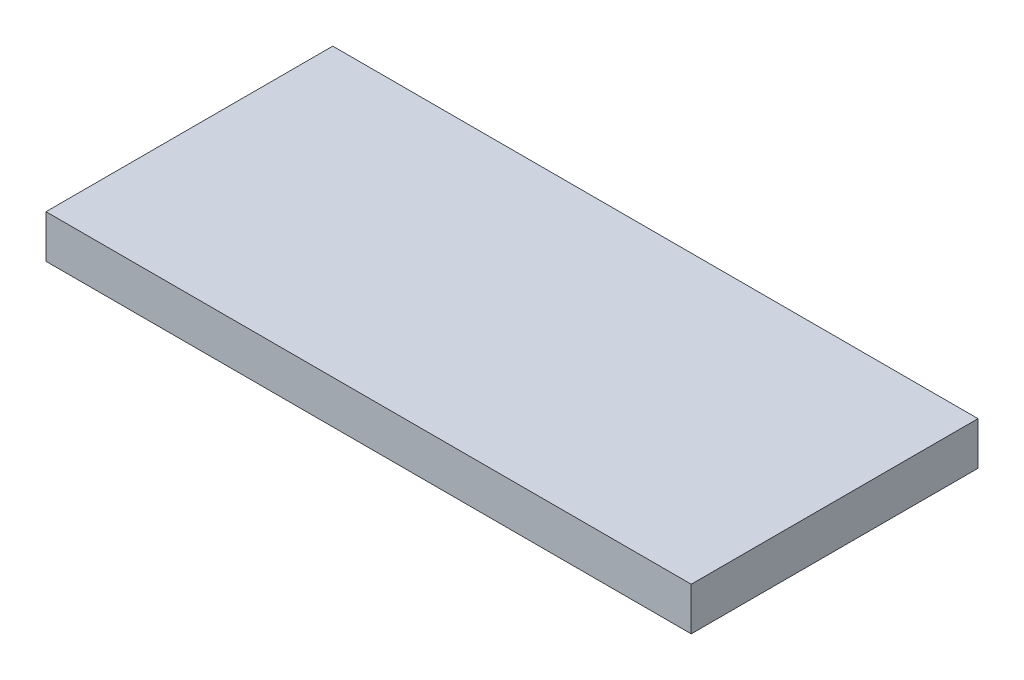
from build123d import *

# Parameters (mm, degrees)
SKETCH1_W           = 45
SKETCH1_H           = 20
BOSS_EXTRUDE1_DEPTH = 3
SKETCH2_W           = 39
SKETCH2_H           = 9.4
CUT_EXTRUDE1_DEPTH  = 1.5


with BuildPart() as part:
    # Sketch1 → Boss-Extrude1 (new body)
    with BuildSketch(Plane(origin=(0, 0, 0), x_dir=(1, 0, 0), z_dir=(0, 1, 0))):
        Rectangle(SKETCH1_W, SKETCH1_H)
    extrude(amount=BOSS_EXTRUDE1_DEPTH)

    # Sketch2 → Cut-Extrude1 (cut)
    with BuildSketch(Plane.XZ):
        Rectangle(SKETCH2_W, SKETCH2_H)
    extrude(amount=-CUT_EXTRUDE1_DEPTH, mode=Mode.SUBTRACT)


solid = part.part
